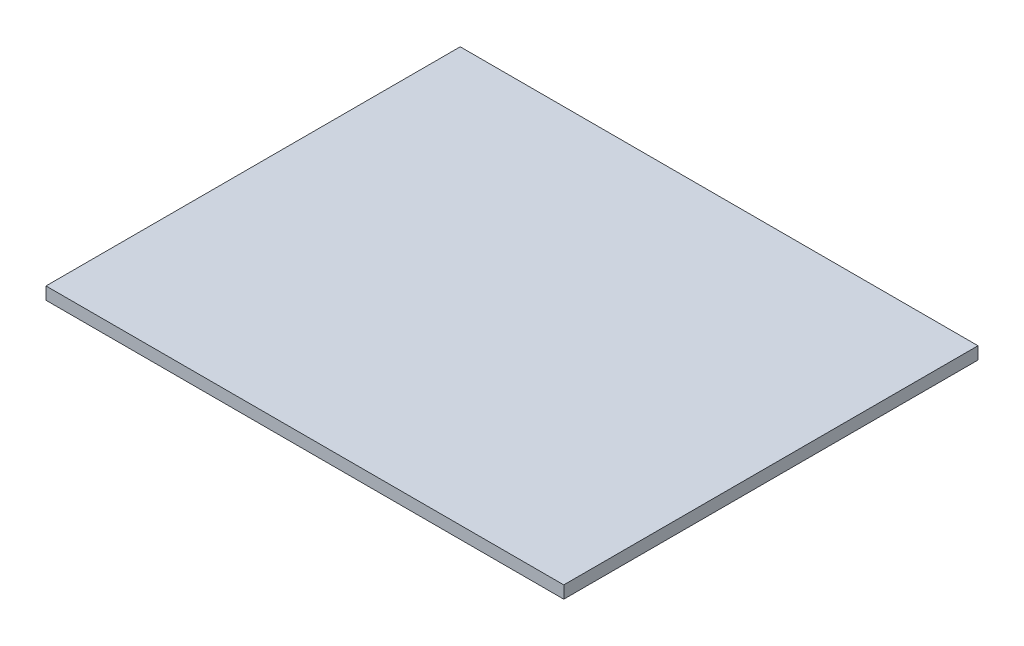
from build123d import *

# Parameters (mm, degrees)
SKETCH1_W           = 25
SKETCH1_H           = 20
BOSS_EXTRUDE1_DEPTH = 0.6


with BuildPart() as part:
    # Sketch1 → Boss-Extrude1 (new body)
    with BuildSketch(Plane(origin=(0, 0, 0), x_dir=(1, 0, 0), z_dir=(0, 1, 0))):
        Rectangle(SKETCH1_W, SKETCH1_H)
    extrude(amount=BOSS_EXTRUDE1_DEPTH)


solid = part.part
